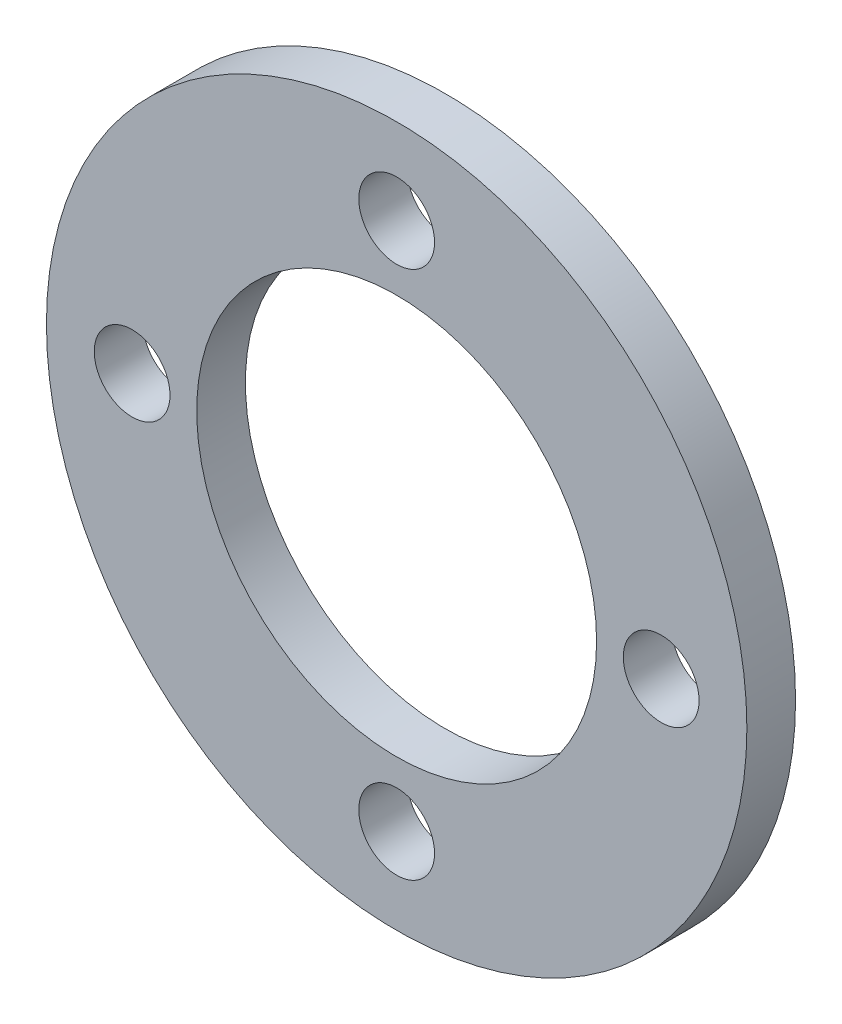
from build123d import *

# Parameters (mm, degrees)
SCHIZZO1_R                   = 14.1
SCHIZZO1_R_2                 = 1.525
SCHIZZO1_R_3                 = 8.05
ESTRUSIONE_ESTRUSIONE1_DEPTH = 1.96


with BuildPart() as part:
    # Schizzo1 → Estrusione-Estrusione1 (new body)
    with BuildSketch(Plane.XY):
        Circle(SCHIZZO1_R)
        with Locations((0, 10.65)):
            Circle(SCHIZZO1_R_2, mode=Mode.SUBTRACT)
        with Locations((10.65, 0)):
            Circle(SCHIZZO1_R_2, mode=Mode.SUBTRACT)
        with Locations((0, -10.65)):
            Circle(SCHIZZO1_R_2, mode=Mode.SUBTRACT)
        with Locations((-10.65, 0)):
            Circle(SCHIZZO1_R_2, mode=Mode.SUBTRACT)
        Circle(SCHIZZO1_R_3, mode=Mode.SUBTRACT)
    extrude(amount=ESTRUSIONE_ESTRUSIONE1_DEPTH)


solid = part.part
